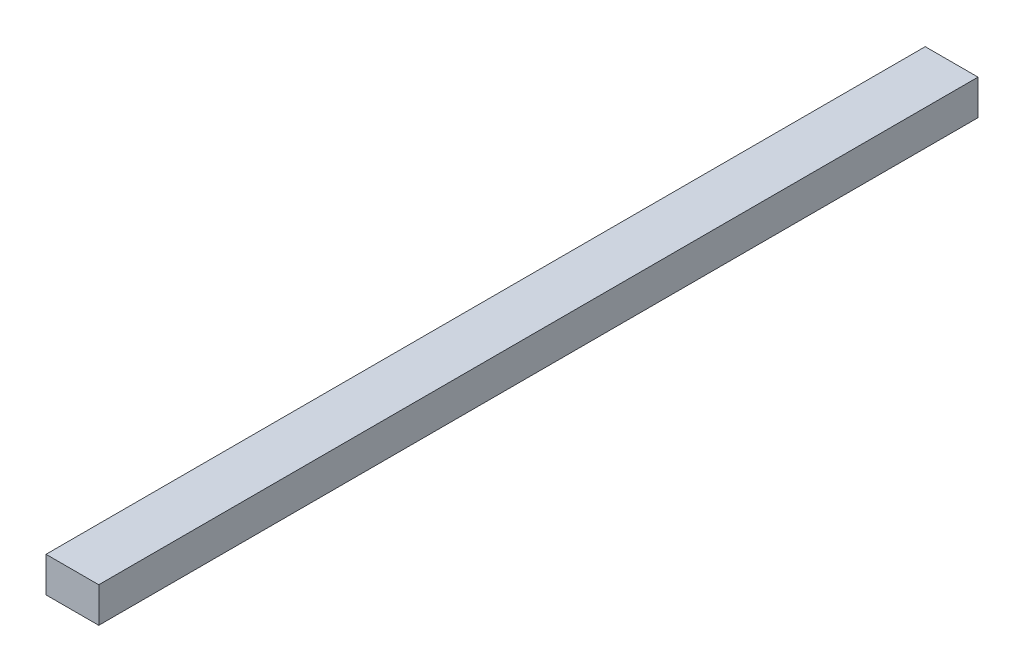
from build123d import *

# Parameters (mm, degrees)
SKETCH1_W           = 30
SKETCH1_H           = 20
BOSS_EXTRUDE1_DEPTH = 500


with BuildPart() as part:
    # Sketch1 → Boss-Extrude1 (new body)
    with BuildSketch(Plane.XY):
        with Locations((3.88038706, -3.032258065)):
            Rectangle(SKETCH1_W, SKETCH1_H)
    extrude(amount=BOSS_EXTRUDE1_DEPTH)


solid = part.part
